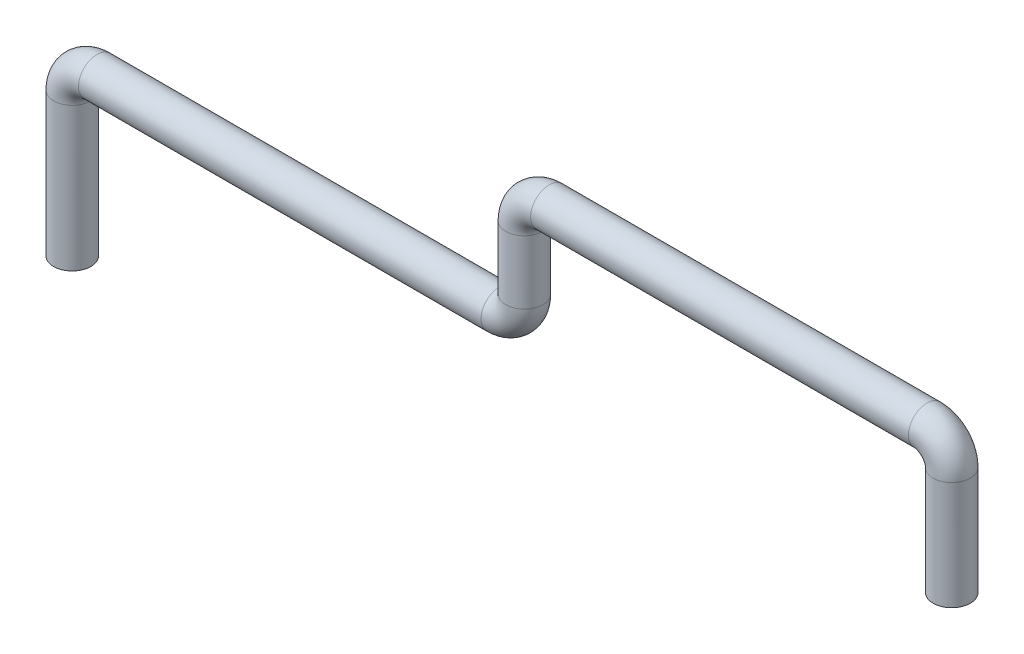
from build123d import *

# Parameters (mm, degrees)
SKETCH2_R = 0.6


with BuildPart() as part:
    # Sweep3: sweep along a path in Sketch1
    with BuildLine(Plane.XY) as sweep3_path:
        Line((0, 0), (0, 4.633286343))
        ThreePointArc((0, 4.633286343), (0.234314575, 5.198971768), (0.8, 5.433286343))
        Line((0.8, 5.433286343), (13.8, 5.433286343))
        ThreePointArc((13.8, 5.433286343), (14.365685425, 5.667600918), (14.6, 6.233286343))
        Line((14.6, 6.233286343), (14.6, 8.283739433))
        ThreePointArc((14.6, 8.283739433), (14.834314575, 8.849424858), (15.4, 9.083739433))
        Line((15.4, 9.083739433), (27.6, 9.083739433))
        ThreePointArc((27.6, 9.083739433), (28.165685425, 8.849424858), (28.4, 8.283739433))
        Line((28.4, 8.283739433), (28.4, 4.783739433))
    # Sketch2 → Sweep3 (sweep)
    with BuildSketch(Plane(origin=(0, 0, 0), x_dir=(1, 0, 0), z_dir=(0, 1, 0))):
        Circle(SKETCH2_R)
    sweep(path=sweep3_path.line)


solid = part.part
